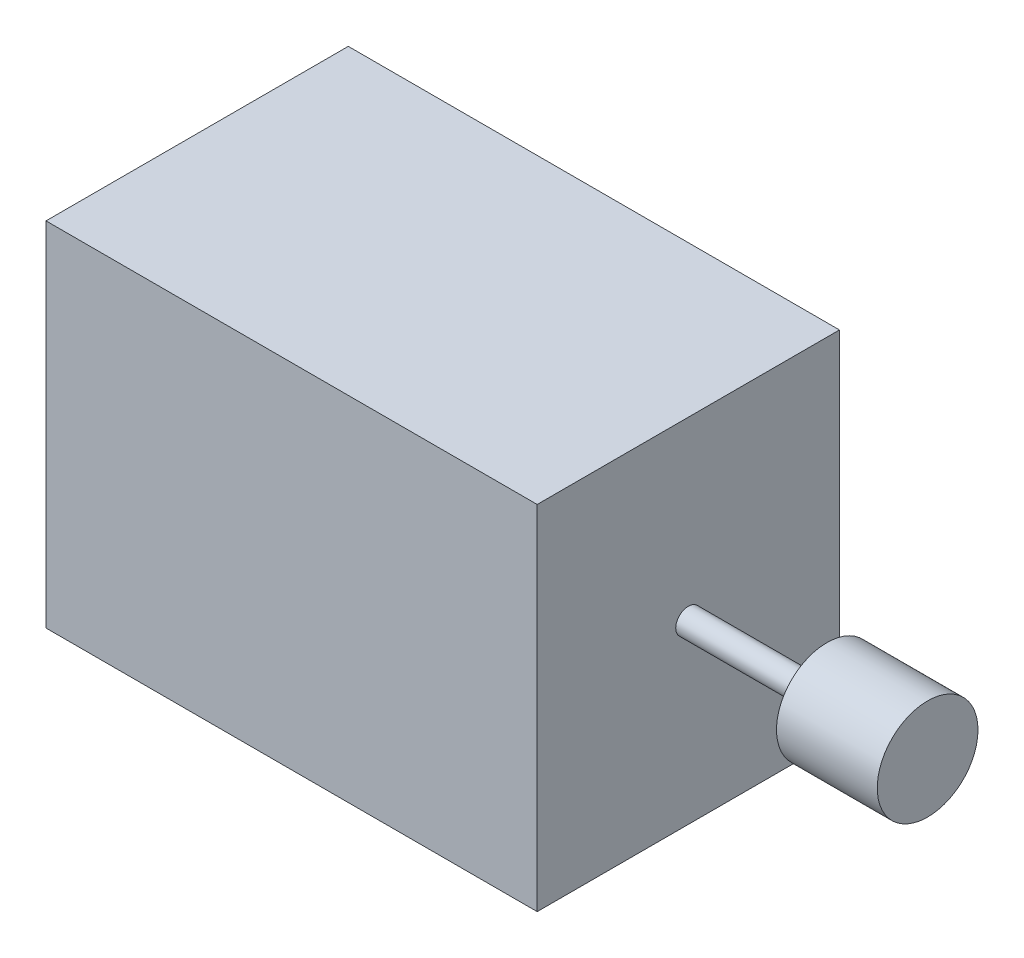
from build123d import *

# Parameters (mm, degrees)
SKETCH2_W           = 39
SKETCH2_H           = 24
BOSS_EXTRUDE1_DEPTH = 14
SKETCH3_R           = 1
BOSS_EXTRUDE2_DEPTH = 11
SKETCH4_R           = 4
BOSS_EXTRUDE3_DEPTH = 8
SKETCH5_R           = 1.4
CUT_EXTRUDE3_DEPTH  = 8


with BuildPart() as part:
    # Sketch2 → Boss-Extrude1 (new, symmetric)
    with BuildSketch(Plane(origin=(0, 0, 0), x_dir=(1, 0, 0), z_dir=(0, 1, 0))):
        Rectangle(SKETCH2_W, SKETCH2_H)
    extrude(amount=BOSS_EXTRUDE1_DEPTH, both=True)

    # Sketch3 → Boss-Extrude2 (add)
    with BuildSketch(Plane(origin=(19.5, 0, 0), x_dir=(0, 0, -1), z_dir=(1, 0, 0))):
        with Locations(Location((0, 0, 0), (0, 0, 180))):
            Circle(SKETCH3_R)
    extrude(amount=BOSS_EXTRUDE2_DEPTH)

    # Sketch4 → Boss-Extrude3 (add)
    with BuildSketch(Plane(origin=(30.5, 0, 0), x_dir=(0, 0, -1), z_dir=(1, 0, 0))):
        Circle(SKETCH4_R)
    extrude(amount=BOSS_EXTRUDE3_DEPTH)

    # Sketch5 → Cut-Extrude3 (cut)
    with BuildSketch(Plane(origin=(0, -14, 0), x_dir=(1, 0, 0), z_dir=(0, 1, 0))):
        with Locations(Location((-9.5, 10.5, 0), (0, 0, 270))):
            Circle(SKETCH5_R)
        with Locations(Location((-9.5, -10.5, 0), (0, 0, 270))):
            Circle(SKETCH5_R)
        with Locations(Location((9.5, 10.5, 0), (0, 0, 270))):
            Circle(SKETCH5_R)
        with Locations(Location((9.5, -10.5, 0), (0, 0, 270))):
            Circle(SKETCH5_R)
    extrude(amount=CUT_EXTRUDE3_DEPTH, mode=Mode.SUBTRACT)


solid = part.part
